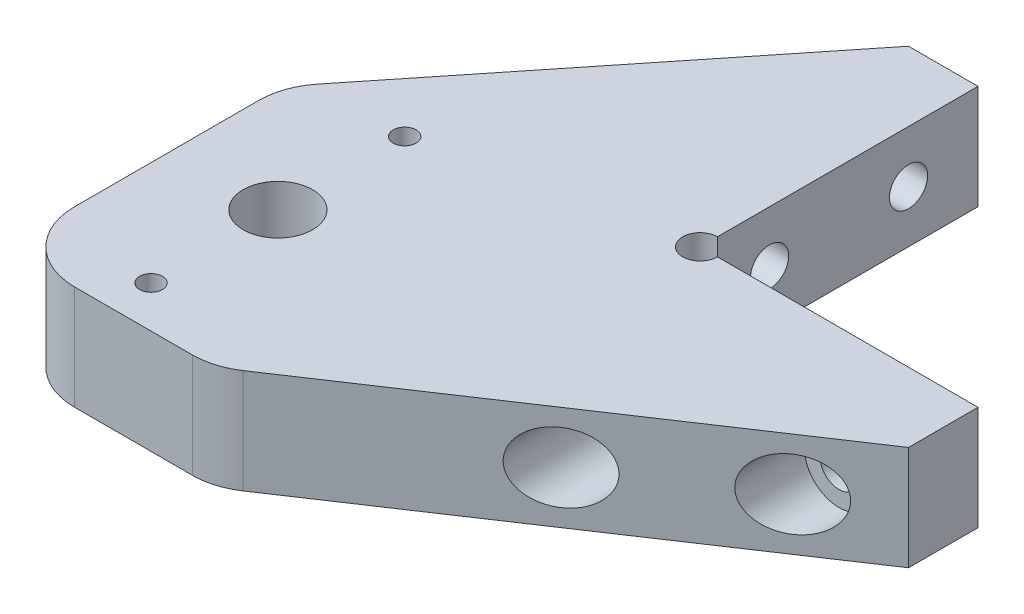
from build123d import *

# Parameters (mm, degrees)
BOSS_EXTRUDE1_DEPTH                                 = 7.5
M4_TAPPED_HOLE1_D                                   = 3.3
SKETCH14_R                                          = 5
CUT_EXTRUDE4_DEPTH                                  = 101.124921973
FILLET1_R                                           = 10
CBORE_FOR_M5_HEX_SOCKET_HEAD_CAP_SCREW1_D           = 5.5
CBORE_FOR_M5_HEX_SOCKET_HEAD_CAP_SCREW1_CBORE_D     = 10
CBORE_FOR_M5_HEX_SOCKET_HEAD_CAP_SCREW1_CBORE_DEPTH = 40
CBORE_FOR_M5_HEX_SOCKET_HEAD_CAP_SCREW2_D           = 5.5
CBORE_FOR_M5_HEX_SOCKET_HEAD_CAP_SCREW2_CBORE_D     = 10
CBORE_FOR_M5_HEX_SOCKET_HEAD_CAP_SCREW2_CBORE_DEPTH = 40
F_5_0_5_DIAMETER_HOLE1_D                            = 5


with BuildPart() as part:
    # Sketch1 → Boss-Extrude1 (new, symmetric)
    with BuildSketch(Plane(origin=(0, 0, 0), x_dir=(1, 0, 0), z_dir=(0, 1, 0))):
        Polygon((-20, 20), (-20, -20), (20, -20), (20, -30), (-40, -70), (-70, -70), (-70, -30), (-30, 20), align=None)
    extrude(amount=BOSS_EXTRUDE1_DEPTH, both=True)

    # M4 Tapped Hole1 (through all)
    with Locations(Plane(origin=(0, 7.5, 0), x_dir=(1, 0, 0), z_dir=(0, 1, 0))):
        with Locations((-55, -27.5), (-55, -64)):
            Hole(M4_TAPPED_HOLE1_D / 2)

    # Sketch14 → Cut-Extrude4 (cut, through all)
    with BuildSketch(Plane(origin=(0, 7.5, 0), x_dir=(1, 0, 0), z_dir=(0, 1, 0))):
        with Locations((-55, -45.75)):
            Circle(SKETCH14_R)
    extrude(amount=-CUT_EXTRUDE4_DEPTH, mode=Mode.SUBTRACT)

    # Fillet1
    fillet1_edges = [part.edges().sort_by_distance(p)[0] for p in [
        (-40, 0, 70),
        (-70, 0, 70),
        (-70, 0, 30),
    ]]
    fillet(fillet1_edges, radius=FILLET1_R)

    # CBORE for M5 Hex Socket Head Cap Screw1 (through all)
    with Locations(Plane.XY.offset(70)):
        with Locations((10, 0), (-10, 0)):
            CounterBoreHole(CBORE_FOR_M5_HEX_SOCKET_HEAD_CAP_SCREW1_D / 2, CBORE_FOR_M5_HEX_SOCKET_HEAD_CAP_SCREW1_CBORE_D / 2, CBORE_FOR_M5_HEX_SOCKET_HEAD_CAP_SCREW1_CBORE_DEPTH)

    # CBORE for M5 Hex Socket Head Cap Screw2 (through all)
    with Locations(Plane.ZY.offset(70)):
        with Locations((10, 0), (-10, 0)):
            CounterBoreHole(CBORE_FOR_M5_HEX_SOCKET_HEAD_CAP_SCREW2_D / 2, CBORE_FOR_M5_HEX_SOCKET_HEAD_CAP_SCREW2_CBORE_D / 2, CBORE_FOR_M5_HEX_SOCKET_HEAD_CAP_SCREW2_CBORE_DEPTH)

    # Ø5.0 (5) Diameter Hole1 (through all)
    with Locations(Plane(origin=(0, 7.5, 0), x_dir=(1, 0, 0), z_dir=(0, 1, 0))):
        with Locations((-20, -20)):
            Hole(F_5_0_5_DIAMETER_HOLE1_D / 2)


solid = part.part
